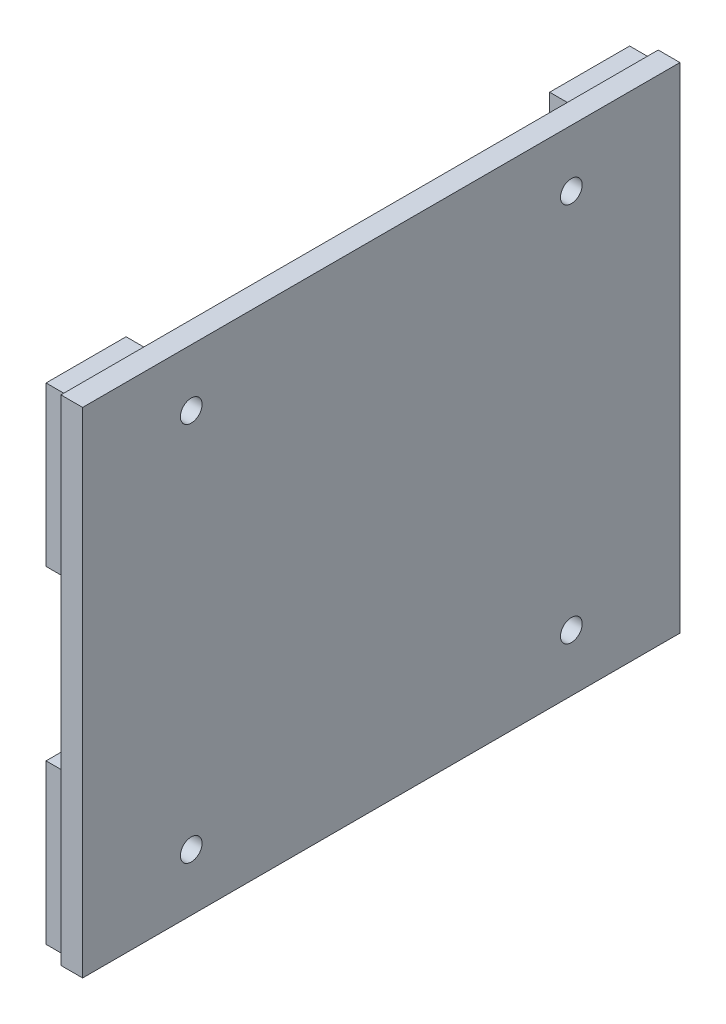
from build123d import *

# Parameters (mm, degrees)
SKETCH1_W           = 174.625
SKETCH1_H           = 144.4625
SKETCH1_R           = 3.175
BOSS_EXTRUDE1_DEPTH = 6.35
SKETCH2_W           = 23.394418878
SKETCH2_H           = 46.463143603
BOSS_EXTRUDE2_DEPTH = 6.35


with BuildPart() as part:
    # Sketch1 → Boss-Extrude1 (new body)
    with BuildSketch(Plane(origin=(0, 0, 0), x_dir=(0, 0, -1), z_dir=(1, 0, 0))):
        Rectangle(SKETCH1_W, SKETCH1_H)
        with Locations((-55.5625, 55.5625)):
            Circle(SKETCH1_R, mode=Mode.SUBTRACT)
        with Locations((55.5625, 55.5625)):
            Circle(SKETCH1_R, mode=Mode.SUBTRACT)
        with Locations((55.5625, -55.5625)):
            Circle(SKETCH1_R, mode=Mode.SUBTRACT)
        with Locations((-55.5625, -55.5625)):
            Circle(SKETCH1_R, mode=Mode.SUBTRACT)
    extrude(amount=BOSS_EXTRUDE1_DEPTH)

    # Sketch2 → Boss-Extrude2 (add)
    with BuildSketch(Plane.ZY):
        with Locations((73.609709439, 47.837821802)):
            Rectangle(SKETCH2_W, SKETCH2_H)
        with Locations((-73.609709439, 47.837821802)):
            Rectangle(SKETCH2_W, SKETCH2_H)
        with Locations((-73.609709439, -47.837821802)):
            Rectangle(SKETCH2_W, SKETCH2_H)
        with Locations((73.609709439, -47.837821802)):
            Rectangle(SKETCH2_W, SKETCH2_H)
    extrude(amount=BOSS_EXTRUDE2_DEPTH)


solid = part.part
